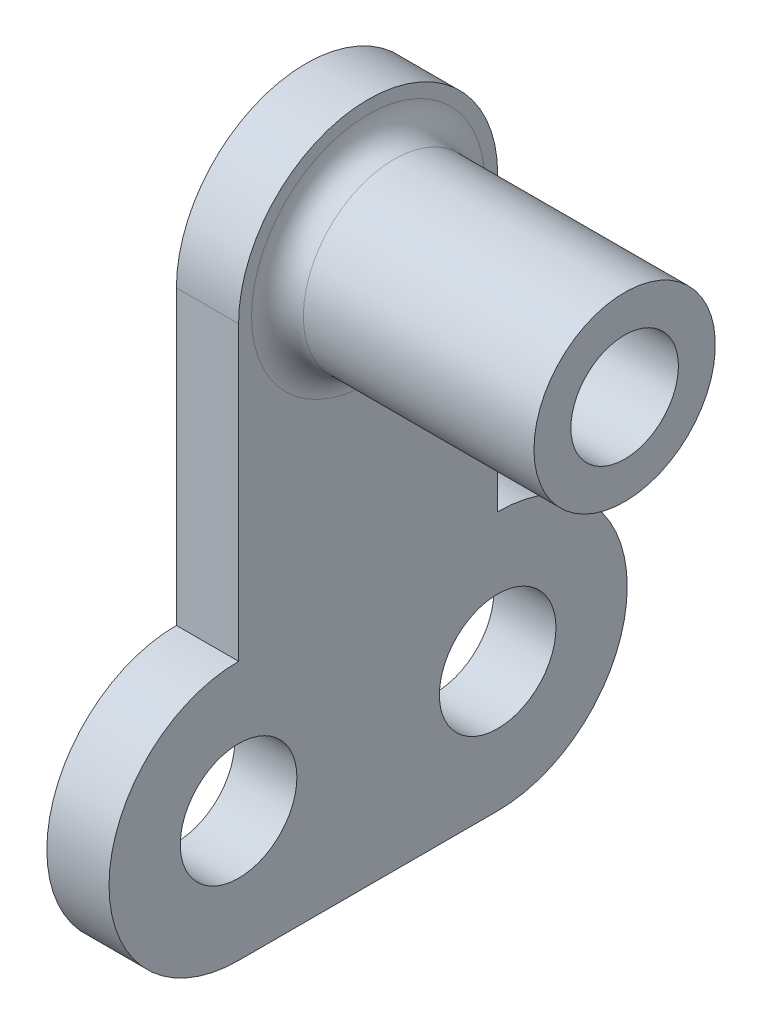
from build123d import *

# Parameters (mm, degrees)
SKETCH_1_R      = 2.25
SKETCH_1_R_2    = 2.075
EXTRUDE_1_DEPTH = 2.4
SKETCH_4_R      = 3.5
SKETCH_4_R_2    = 2.075
EXTRUDE_2_DEPTH = 9.9
FILLET_1_R      = 1
SKETCH_5_R      = 2.075
SKETCH_5_R_2    = 1.2
EXTRUDE_3_DEPTH = 4


with BuildPart() as part:
    # 草图1 → 凸台-拉伸1 (new body)
    with BuildSketch(Plane(origin=(0, 0, 0), x_dir=(0, 0, -1), z_dir=(1, 0, 0))):
        with BuildLine():
            Line((-5, 0), (5, 0))
            ThreePointArc((5, 0), (10, 5), (5, 10))
            Line((5, 10), (5, 21.282156306))
            ThreePointArc((5, 21.282156306), (0, 26.282156306), (-5, 21.282156306))
            Line((-5, 21.282156306), (-5, 10))
            ThreePointArc((-5, 10), (-10, 5), (-5, 0))
        make_face()
        with Locations((-5, 5)):
            Circle(SKETCH_1_R, mode=Mode.SUBTRACT)
        with Locations((5, 5)):
            Circle(SKETCH_1_R, mode=Mode.SUBTRACT)
        with Locations((0, 21.282156306)):
            Circle(SKETCH_1_R_2, mode=Mode.SUBTRACT)
    extrude(amount=EXTRUDE_1_DEPTH)

    # 草图4 → 凸台-拉伸2 (add)
    with BuildSketch(Plane(origin=(2.4, 0, 0), x_dir=(0, 0, -1), z_dir=(1, 0, 0))):
        with Locations(Location((0, 21.282156306, 0), (0, 0, 180))):
            Circle(SKETCH_4_R)
        with Locations((0, 21.282156306)):
            Circle(SKETCH_4_R_2, mode=Mode.SUBTRACT)
    extrude(amount=EXTRUDE_2_DEPTH)

    # 圆角1
    fillet_1_edges = [part.edges().sort_by_distance(p)[0] for p in [
        (2.4, 21.282156306, -3.5),
    ]]
    fillet(fillet_1_edges, radius=FILLET_1_R)

    # 草图5 → 凸台-拉伸3 (add)
    with BuildSketch(Plane.ZY):
        with Locations((0, 21.282156306)):
            Circle(SKETCH_5_R)
        with Locations((0, 21.282156306)):
            Circle(SKETCH_5_R_2, mode=Mode.SUBTRACT)
    extrude(amount=-EXTRUDE_3_DEPTH)


solid = part.part
